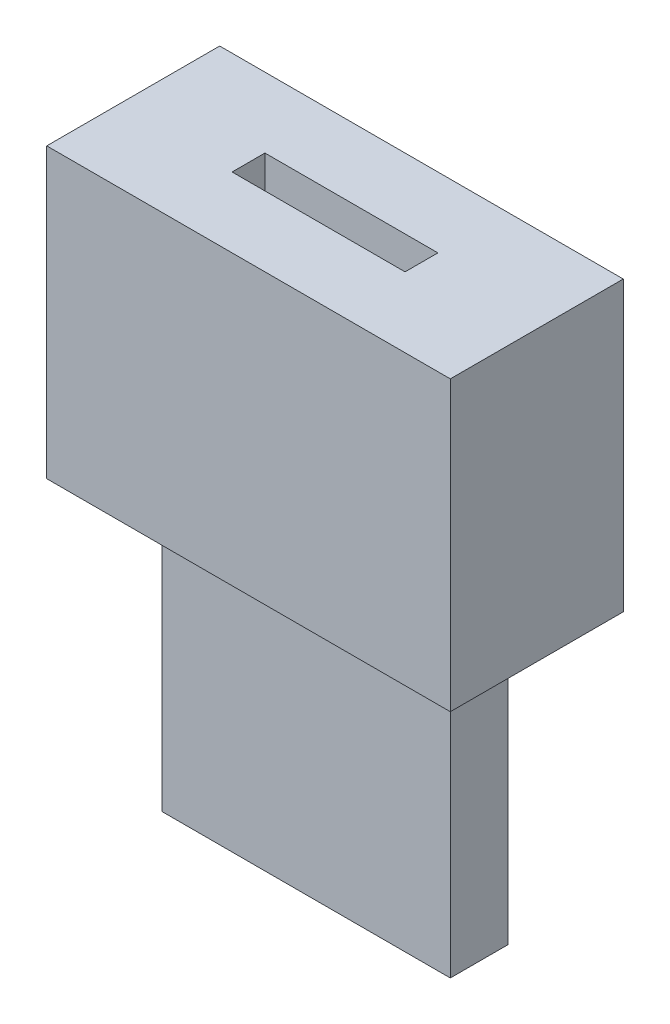
from build123d import *

# Parameters (mm, degrees)
SKETCH1_W           = 35
SKETCH1_H           = 15
SKETCH1_W_2         = 15
SKETCH1_H_2         = 2.849239826
BOSS_EXTRUDE1_DEPTH = 25
SKETCH1_3_W         = 25
SKETCH1_3_H         = 5
SKETCH1_3_W_2       = 15
SKETCH1_3_H_2       = 2.849239826
BOSS_EXTRUDE2_DEPTH = 25


with BuildPart() as part:
    # Sketch1 → Boss-Extrude1 (new body)
    with BuildSketch(Plane(origin=(0, 0, 0), x_dir=(1, 0, 0), z_dir=(0, 1, 0))):
        Rectangle(SKETCH1_W, SKETCH1_H)
        Rectangle(SKETCH1_W_2, SKETCH1_H_2, mode=Mode.SUBTRACT)
    extrude(amount=BOSS_EXTRUDE1_DEPTH)

    # Sketch1<3> → Boss-Extrude2 (add)
    with BuildSketch(Plane(origin=(0, 0, 0), x_dir=(1, 0, 0), z_dir=(0, 1, 0))):
        Rectangle(SKETCH1_3_W, SKETCH1_3_H)
        Rectangle(SKETCH1_3_W_2, SKETCH1_3_H_2, mode=Mode.SUBTRACT)
    extrude(amount=-BOSS_EXTRUDE2_DEPTH)


solid = part.part
